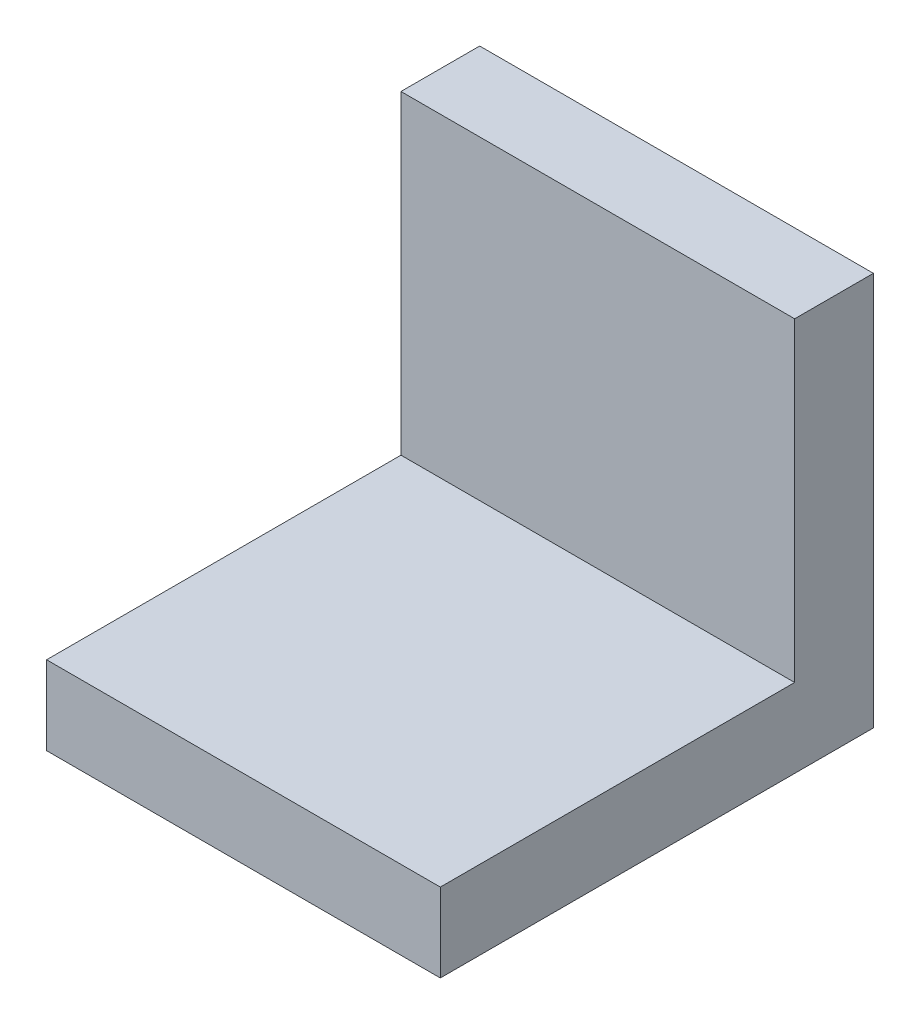
from build123d import *

# Parameters (mm, degrees)
BOSS_EXTRU_1_DEPTH = 25


with BuildPart() as part:
    # Esquisse1 → Boss.-Extru.1 (new, symmetric)
    with BuildSketch(Plane(origin=(0, 0, 0), x_dir=(0, 0, -1), z_dir=(1, 0, 0))):
        Polygon((-27.5, 0), (27.5, 0), (27.5, 50), (17.5, 50), (17.5, 10), (-27.5, 10), align=None)
    extrude(amount=BOSS_EXTRU_1_DEPTH, both=True)


solid = part.part
